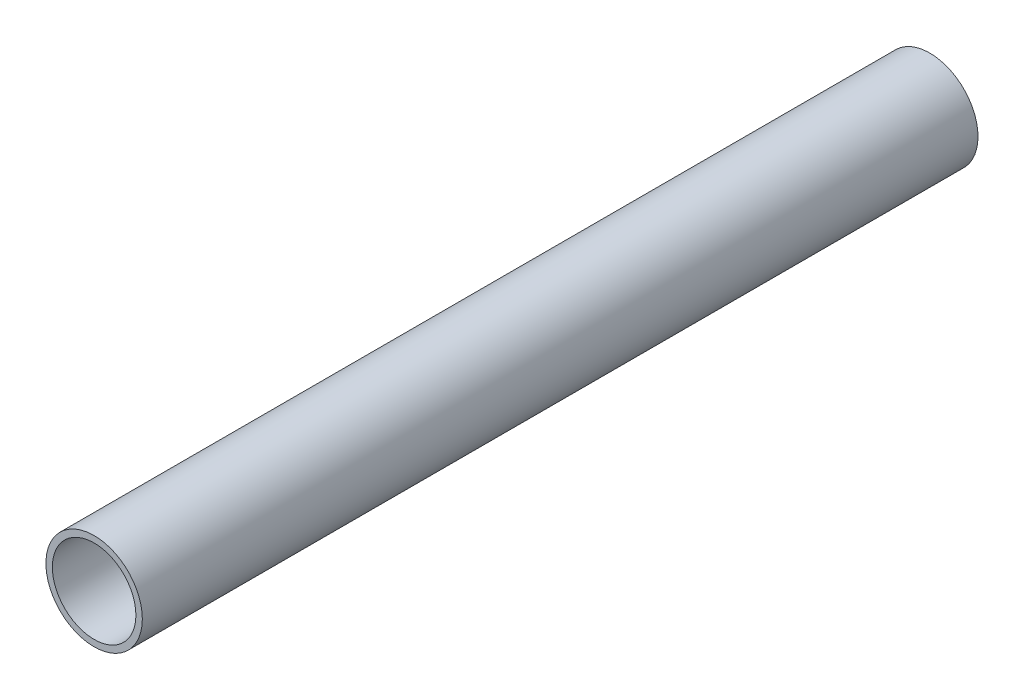
from build123d import *

# Parameters (mm, degrees)
SKETCH_1_R      = 15
SKETCH_1_R_2    = 13
EXTRUDE_1_DEPTH = 260


with BuildPart() as part:
    # 草图1 → 凸台-拉伸1 (new body)
    with BuildSketch(Plane.XY):
        Circle(SKETCH_1_R)
        Circle(SKETCH_1_R_2, mode=Mode.SUBTRACT)
    extrude(amount=EXTRUDE_1_DEPTH)


solid = part.part
